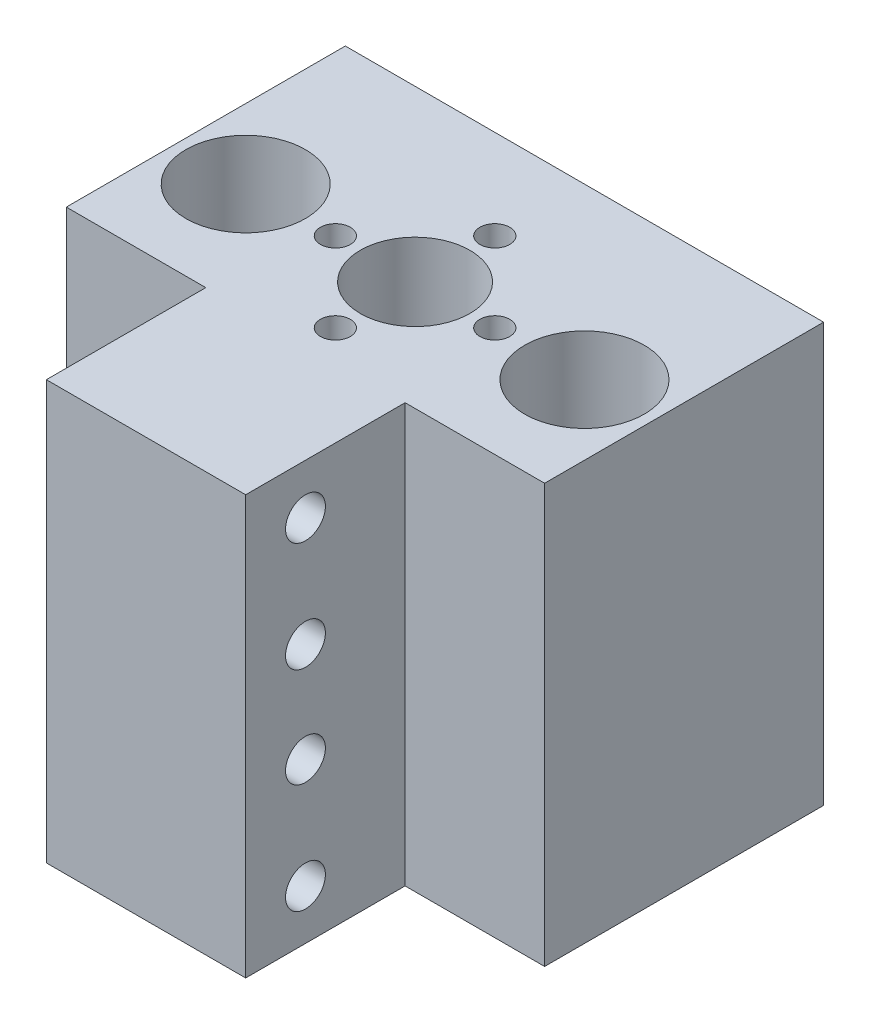
from build123d import *

# Parameters (mm, degrees)
SKETCH_1_W          = 48
SKETCH_1_H          = 42
EXTRUDE_1_DEPTH     = 38
SKETCH_3_R          = 6
SKETCH_3_R_2        = 5.5
SKETCH_3_R_3        = 1.5
CUT_EXTRUDE_2_DEPTH = 62.514225997
SKETCH_9_W          = 14
SKETCH_9_H          = 10
CUT_EXTRUDE_6_DEPTH = 62.514225997
SKETCH_10_W         = 20
SKETCH_10_H         = 6
EXTRUDE_3_DEPTH     = 42
SKETCH_11_R         = 2
CUT_EXTRUDE_7_DEPTH = 60.439044407


with BuildPart() as part:
    # 草圖1 → 填料-伸長1 (new body)
    with BuildSketch(Plane.XY):
        Rectangle(SKETCH_1_W, SKETCH_1_H)
    extrude(amount=EXTRUDE_1_DEPTH)

    # 草圖3 → 除料-伸長2 (cut, through all)
    with BuildSketch(Plane(origin=(0, 21, 0), x_dir=(1, 0, 0), z_dir=(0, 1, 0))):
        with Locations(Location((17, -17, 0), (0, 0, 270))):
            Circle(SKETCH_3_R)
        with Locations(Location((-17, -17, 0), (0, 0, 270))):
            Circle(SKETCH_3_R)
        with Locations(Location((0, -17, 0), (0, 0, 270))):
            Circle(SKETCH_3_R_2)
        with Locations(Location((0, -25, 0), (0, 0, 270))):
            Circle(SKETCH_3_R_3)
        with Locations(Location((8, -17, 0), (0, 0, 270))):
            Circle(SKETCH_3_R_3)
        with Locations(Location((0, -9, 0), (0, 0, 270))):
            Circle(SKETCH_3_R_3)
        with Locations(Location((-8, -17, 0), (0, 0, 270))):
            Circle(SKETCH_3_R_3)
    extrude(amount=-CUT_EXTRUDE_2_DEPTH, mode=Mode.SUBTRACT)

    # 草圖9 → 除料-伸長6 (cut, through all)
    with BuildSketch(Plane(origin=(0, 21, 0), x_dir=(1, 0, 0), z_dir=(0, 1, 0))):
        with Locations((-17, -33)):
            Rectangle(SKETCH_9_W, SKETCH_9_H)
        with Locations((17, -33)):
            Rectangle(SKETCH_9_W, SKETCH_9_H)
    extrude(amount=-CUT_EXTRUDE_6_DEPTH, mode=Mode.SUBTRACT)

    # 草圖10 → 填料-伸長3 (add)
    with BuildSketch(Plane(origin=(0, 21, 0), x_dir=(1, 0, 0), z_dir=(0, 1, 0))):
        with Locations((0, -41)):
            Rectangle(SKETCH_10_W, SKETCH_10_H)
    extrude(amount=-EXTRUDE_3_DEPTH)

    # 草圖11 → 除料-伸長7 (cut, through all)
    with BuildSketch(Plane(origin=(10, 0, 0), x_dir=(0, 0, -1), z_dir=(1, 0, 0))):
        with Locations((-38, 16)):
            Circle(SKETCH_11_R)
        with Locations((-38, 5)):
            Circle(SKETCH_11_R)
        with Locations((-38, -5)):
            Circle(SKETCH_11_R)
        with Locations((-38, -16)):
            Circle(SKETCH_11_R)
    extrude(amount=-CUT_EXTRUDE_7_DEPTH, mode=Mode.SUBTRACT)


solid = part.part
